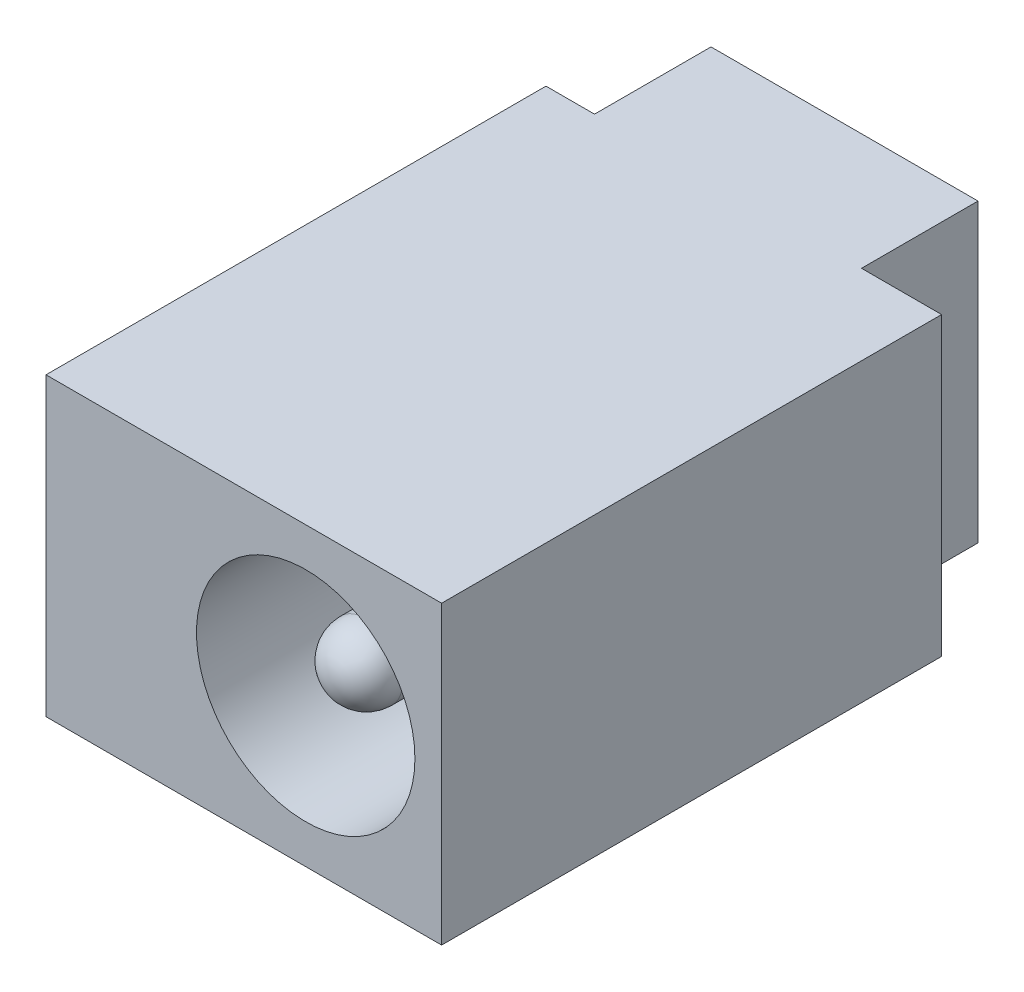
from build123d import *

# Parameters (mm, degrees)
EXTRUDE_1_DEPTH     = 6.1
SKETCH_2_R          = 2.25
CUT_EXTRUDE_1_DEPTH = 8
SKETCH_3_R          = 0.75
EXTRUDE_2_DEPTH     = 7.5
FILLET_1_R          = 0.75


with BuildPart() as part:
    # Эскиз1 → Бобышка-Вытянуть1 (new body)
    with BuildSketch(Plane(origin=(0, 0, 0), x_dir=(1, 0, 0), z_dir=(0, 1, 0))):
        Polygon((-4.075, 3.95), (-3.075, 3.95), (-3.075, 6.35), (2.425, 6.35), (2.425, 3.95), (4.075, 3.95), (4.075, -6.35), (-4.075, -6.35), align=None)
    extrude(amount=EXTRUDE_1_DEPTH)

    # Эскиз2 → Вырез-Вытянуть1 (cut)
    with BuildSketch(Plane.XY.offset(6.35)):
        with Locations((1.275, 3.05)):
            Circle(SKETCH_2_R)
    extrude(amount=-CUT_EXTRUDE_1_DEPTH, mode=Mode.SUBTRACT)

    # Эскиз3 → Бобышка-Вытянуть2 (add)
    with BuildSketch(Plane.XY.offset(-1.65)):
        with Locations((1.275, 3.05)):
            Circle(SKETCH_3_R)
    extrude(amount=EXTRUDE_2_DEPTH)

    # Скругление1
    fillet_1_edges = [part.edges().sort_by_distance(p)[0] for p in [
        (0.525, 3.05, 5.85),
    ]]
    fillet(fillet_1_edges, radius=FILLET_1_R)


solid = part.part
